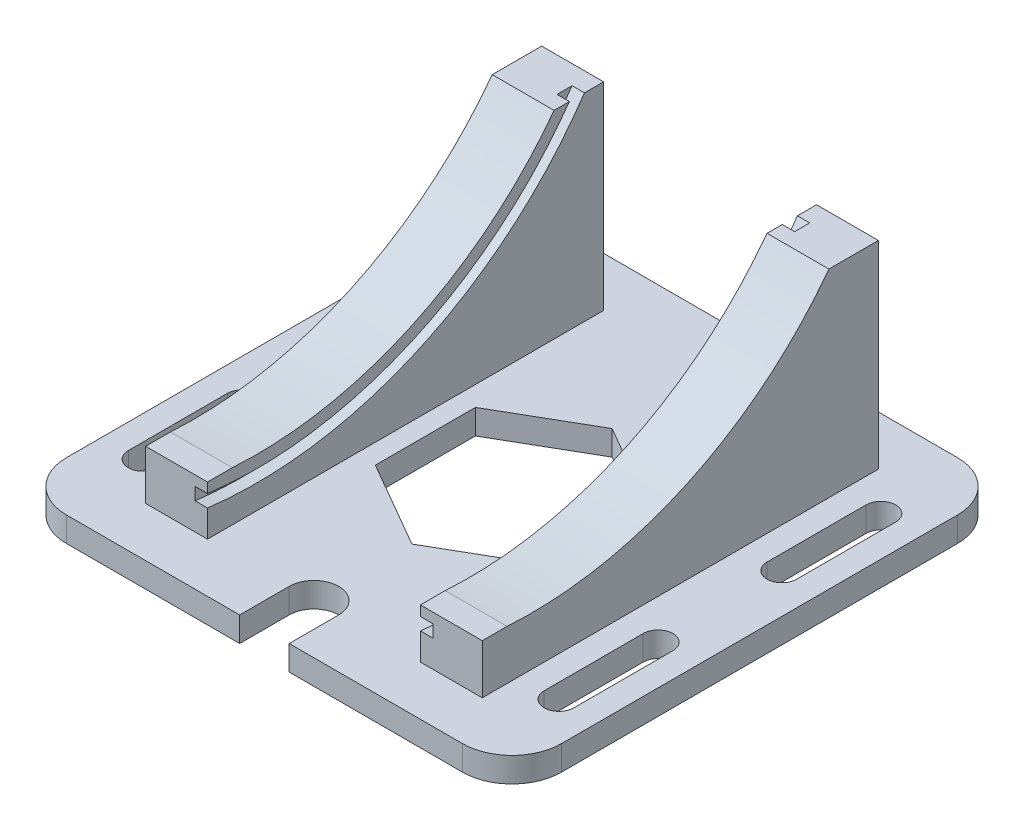
from build123d import *

# Parameters (mm, degrees)
CROQUIS2_W              = 100
CROQUIS2_H              = 100
SALIENTE_EXTRUIR1_DEPTH = 5
REDONDEO1_R             = 10
CORTAR_EXTRUIR1_DEPTH   = 5
CROQUIS4_W              = 10
CROQUIS4_H              = 80
SALIENTE_EXTRUIR2_DEPTH = 40
CORTAR_EXTRUIR2_DEPTH   = 84
SALIENTE_EXTRUIR4_START = 2.5
SALIENTE_EXTRUIR4_DEPTH = 2.5
SALIENTE_EXTRUIR5_DEPTH = 2.5


with BuildPart() as part:
    # Croquis2 → Saliente-Extruir1 (new body)
    with BuildSketch(Plane(origin=(0, 0, 0), x_dir=(1, 0, 0), z_dir=(0, 1, 0))):
        Rectangle(CROQUIS2_W, CROQUIS2_H)
    extrude(amount=SALIENTE_EXTRUIR1_DEPTH)

    # Redondeo1
    redondeo1_edges = [part.edges().sort_by_distance(p)[0] for p in [
        (-50, 2.5, -50),
        (50, 2.5, -50),
        (50, 2.5, 50),
        (-50, 2.5, 50),
    ]]
    fillet(redondeo1_edges, radius=REDONDEO1_R)

    # Croquis3 → Cortar-Extruir1 (cut)
    with BuildSketch(Plane(origin=(0, 5, 0), x_dir=(1, 0, 0), z_dir=(0, 1, 0))):
        with BuildLine():
            Line((-5, -50), (5, -50))
            Line((5, -50), (5, -40))
            ThreePointArc((5, -40), (0, -35), (-5, -40))
            Line((-5, -40), (-5, -50))
        make_face()
        with BuildLine():
            Line((-39, 32.5), (-39, 12.5))
            ThreePointArc((-39, 12.5), (-42, 9.5), (-45, 12.5))
            Line((-45, 12.5), (-45, 32.5))
            ThreePointArc((-45, 32.5), (-42, 35.5), (-39, 32.5))
        make_face()
        with BuildLine():
            Line((45, 32.5), (45, 12.5))
            ThreePointArc((45, 12.5), (42, 9.5), (39, 12.5))
            Line((39, 12.5), (39, 32.5))
            ThreePointArc((39, 32.5), (42, 35.5), (45, 32.5))
        make_face()
        with BuildLine():
            Line((-39, -12.5), (-39, -32.5))
            ThreePointArc((-39, -32.5), (-42, -35.5), (-45, -32.5))
            Line((-45, -32.5), (-45, -12.5))
            ThreePointArc((-45, -12.5), (-42, -9.5), (-39, -12.5))
        make_face()
        with BuildLine():
            Line((45, -12.5), (45, -32.5))
            ThreePointArc((45, -32.5), (42, -35.5), (39, -32.5))
            Line((39, -32.5), (39, -12.5))
            ThreePointArc((39, -12.5), (42, -9.5), (45, -12.5))
        make_face()
        Polygon((0, 20.207259422), (-17.5, 10.103629711), (-17.5, -10.103629711), (0, -20.207259422), (17.5, -10.103629711), (17.5, 10.103629711), align=None)
    extrude(amount=-CORTAR_EXTRUIR1_DEPTH, mode=Mode.SUBTRACT)

    # Croquis4 → Saliente-Extruir2 (add)
    with BuildSketch(Plane(origin=(0, 5, 0), x_dir=(1, 0, 0), z_dir=(0, 1, 0))):
        with Locations((-29, 0)):
            Rectangle(CROQUIS4_W, CROQUIS4_H)
        with Locations((29, 0)):
            Rectangle(CROQUIS4_W, CROQUIS4_H)
    extrude(amount=SALIENTE_EXTRUIR2_DEPTH)

    # Croquis5 → Cortar-Extruir2 (cut)
    with BuildSketch(Plane(origin=(34, 0, 0), x_dir=(0, 0, -1), z_dir=(1, 0, 0))):
        with BuildLine():
            Line((-40, 15), (-35, 15))
            ThreePointArc((-35, 15), (1.310440846, 21.744044834), (30, 45))
            Line((30, 45), (-40, 45))
            Line((-40, 45), (-40, 15))
        make_face()
    extrude(amount=-CORTAR_EXTRUIR2_DEPTH, mode=Mode.SUBTRACT)

    # Croquis8 → Saliente-Extruir4 (add)
    with BuildSketch(Plane(origin=(-24, 0, 0), x_dir=(0, 0, -1), z_dir=(1, 0, 0)).offset(SALIENTE_EXTRUIR4_START)):
        with BuildLine():
            Line((-40, 12.973487285), (-40, 15))
            Line((-40, 15), (-35, 15))
            ThreePointArc((-35, 15), (1.310440846, 21.744044834), (30, 45))
            Line((30, 45), (33.091320679, 45))
            ThreePointArc((33.091320679, 45), (0.984523571, 18.856312683), (-40, 12.973487285))
        make_face()
    saliente_extruir4 = extrude(amount=-SALIENTE_EXTRUIR4_DEPTH)

    # Croquis9 → Saliente-Extruir5 (add)
    with BuildSketch(Plane(origin=(-24, 0, 0), x_dir=(0, 0, -1), z_dir=(1, 0, 0))):
        with BuildLine():
            Line((-40, 10.453567004), (-40, 5))
            Line((-40, 5), (40, 5))
            Line((40, 5), (40, 45))
            Line((40, 45), (36.132755539, 45))
            ThreePointArc((36.132755539, 45), (2.938227405, 16.990296255), (-40, 10.453567004))
        make_face()
    saliente_extruir5 = extrude(amount=SALIENTE_EXTRUIR5_DEPTH)

    # Simetría1: Saliente-Extruir4, Saliente-Extruir5 across plane
    add(saliente_extruir4.mirror(Plane(origin=(0, 0, 0), x_dir=(0, 0, 1), z_dir=(1, 0, 0))))
    add(saliente_extruir5.mirror(Plane(origin=(0, 0, 0), x_dir=(0, 0, 1), z_dir=(1, 0, 0))))


solid = part.part
